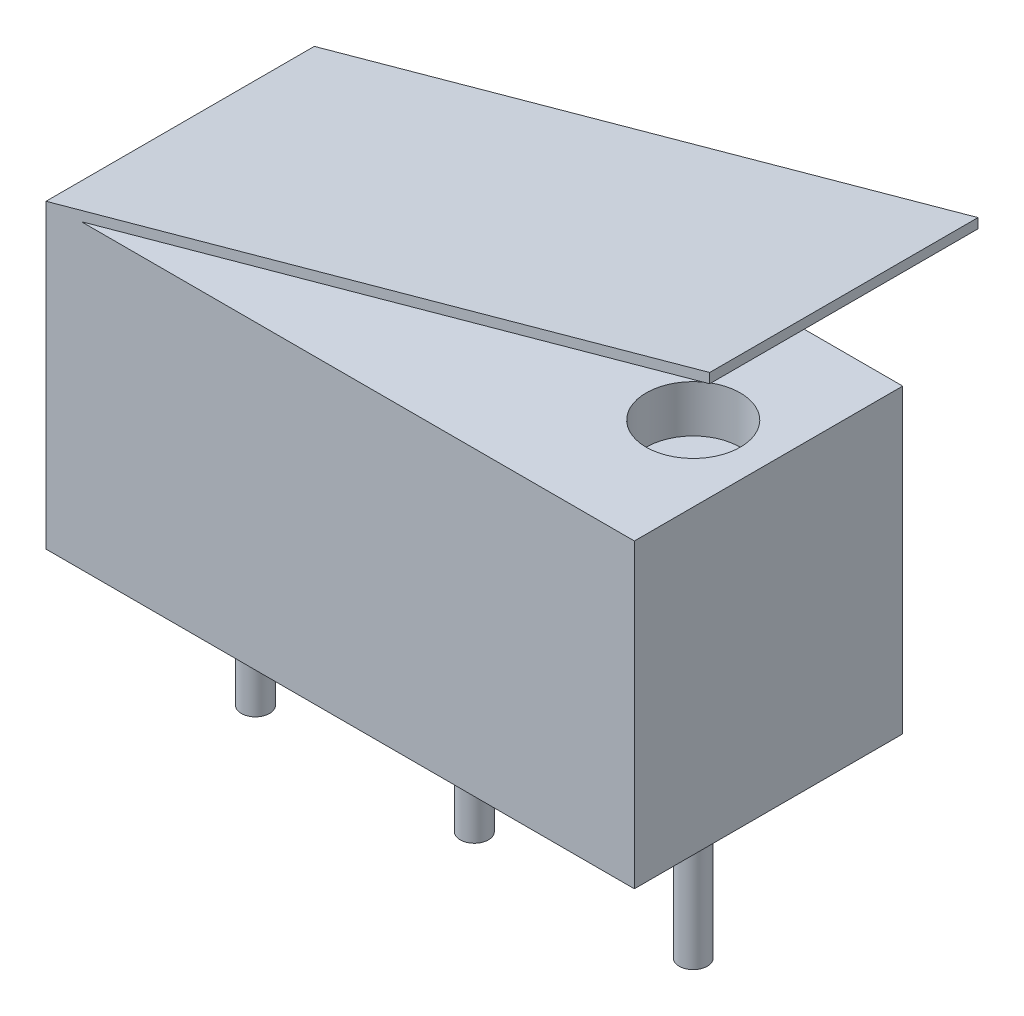
from build123d import *

# Parameters (mm, degrees)
SKETCH1_W           = 12.5
SKETCH1_H           = 5.7
BOSS_EXTRUDE1_DEPTH = 6.4
BOSS_EXTRUDE2_DEPTH = 5.7
SKETCH3_R           = 0.3
BOSS_EXTRUDE3_DEPTH = 3.5
SKETCH4_R           = 1
CUT_EXTRUDE1_DEPTH  = 1


with BuildPart() as part:
    # Sketch1 → Boss-Extrude1 (new body)
    with BuildSketch(Plane(origin=(0, 0, 0), x_dir=(1, 0, 0), z_dir=(0, 1, 0))):
        with Locations((1.136363636, 0.50625)):
            Rectangle(SKETCH1_W, SKETCH1_H)
    extrude(amount=BOSS_EXTRUDE1_DEPTH)

    # Sketch2 → Boss-Extrude2 (add)
    with BuildSketch(Plane.XY.offset(2.34375)):
        Polygon((-5.113636364, 6.4), (8.986363636, 10.3), (8.986363636, 10.092490462), (-5.113636364, 6.192490462), align=None)
    extrude(amount=-BOSS_EXTRUDE2_DEPTH)

    # Sketch3 → Boss-Extrude3 (add)
    with BuildSketch(Plane.XZ):
        with Locations(Location((-3.513636364, -0.50625, 0), (0, 0, 90))):
            Circle(SKETCH3_R)
        with Locations(Location((1.136363636, -0.50625, 0), (0, 0, 90))):
            Circle(SKETCH3_R)
        with Locations(Location((5.786363636, -0.50625, 0), (0, 0, 90))):
            Circle(SKETCH3_R)
    extrude(amount=BOSS_EXTRUDE3_DEPTH)

    # Sketch4 → Cut-Extrude1 (cut)
    with BuildSketch(Plane(origin=(0, 6.4, 0), x_dir=(1, 0, 0), z_dir=(0, 1, 0))):
        with Locations(Location((5.786363636, 0.50625, 0), (0, 0, 270))):
            Circle(SKETCH4_R)
    extrude(amount=-CUT_EXTRUDE1_DEPTH, mode=Mode.SUBTRACT)


solid = part.part
